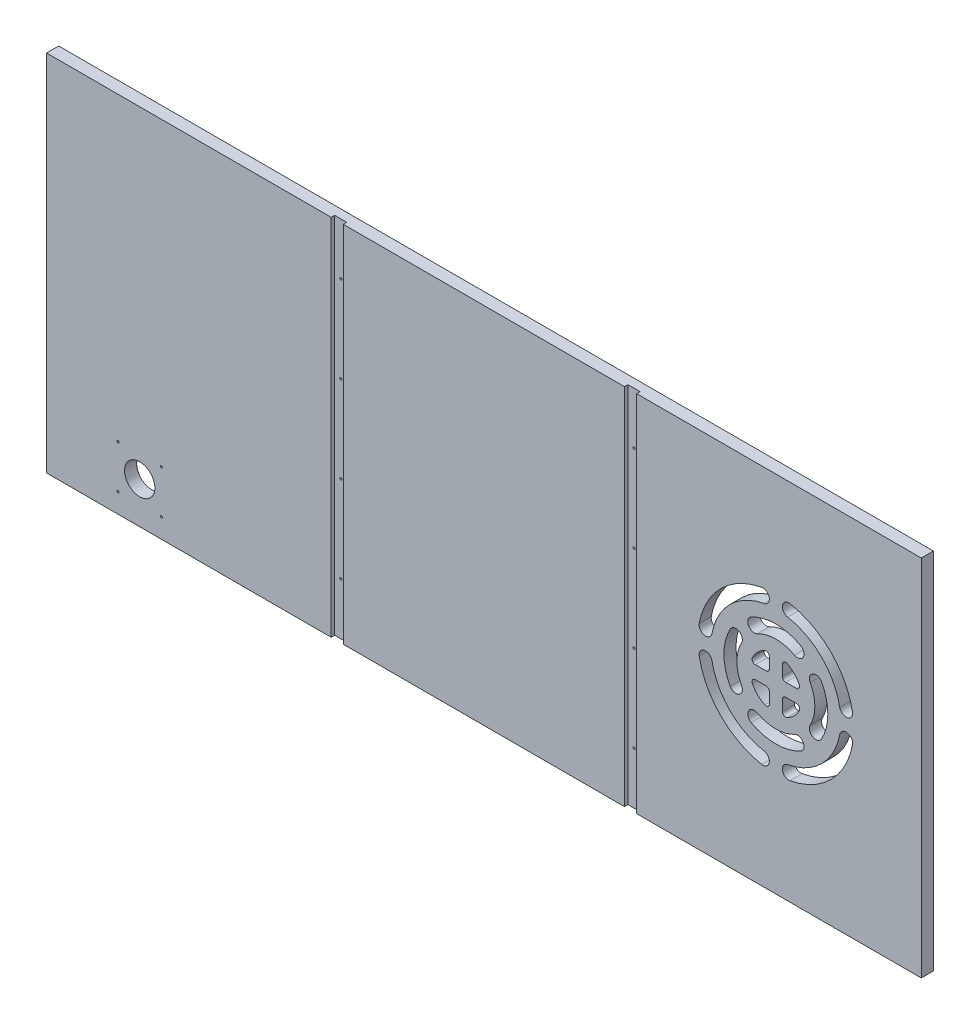
from build123d import *

# Parameters (mm, degrees)
SKETCH2_W          = 1282.7
SKETCH2_H          = 533.4
EXTRUDE1_DEPTH     = 17.78
SKETCH4_R          = 22.225
SKETCH4_R_2        = 1.5875
SKETCH4_R_3        = 1.628860789
SKETCH4_R_4        = 1.721410862
CUT_EXTRUDE1_DEPTH = 17.78
CUT_EXTRUDE2_DEPTH = 5.08


with BuildPart() as part:
    # Sketch2 → Extrude1 (new body)
    with BuildSketch(Plane.XY):
        with Locations((9556.220833334, -6075.3625)):
            Rectangle(SKETCH2_W, SKETCH2_H)
    extrude(amount=-EXTRUDE1_DEPTH)

    # Sketch4 → Cut-Extrude1 (cut)
    with BuildSketch(Plane.XY):
        with Locations((9051.395833334, -6281.7375)):
            Circle(SKETCH4_R)
        with Locations((9019.645833334, -6249.9875)):
            Circle(SKETCH4_R_2)
        with Locations((9083.145833334, -6249.9875)):
            Circle(SKETCH4_R_2)
        with Locations((9083.145833334, -6313.4875)):
            Circle(SKETCH4_R_3)
        with Locations((9019.645833334, -6313.4875)):
            Circle(SKETCH4_R_4)
        with Locations((9341.1675, -6265.8625)):
            Circle(SKETCH4_R_2)
        with Locations((9341.1675, -6138.8625)):
            Circle(SKETCH4_R_2)
        with Locations((9341.1675, -6011.8625)):
            Circle(SKETCH4_R_2)
        with Locations((9341.1675, -5884.8625)):
            Circle(SKETCH4_R_2)
        with Locations((9771.274166666, -5884.8625)):
            Circle(SKETCH4_R_2)
        with Locations((9771.274166666, -6011.8625)):
            Circle(SKETCH4_R_2)
        with Locations((9771.274166666, -6138.8625)):
            Circle(SKETCH4_R_2)
        with Locations((9771.274166666, -6265.8625)):
            Circle(SKETCH4_R_2)
        with BuildLine():
            Line((9974.787433334, -6061.075), (9974.787433334, -6045.241805286))
            ThreePointArc((9974.787433334, -6045.241805286), (9972.570596663, -6041.216758148), (9967.983861906, -6040.938848899))
            ThreePointArc((9967.983861906, -6040.938848899), (9957.371664972, -6048.421731638), (9949.888782233, -6059.033928571))
            ThreePointArc((9949.888782233, -6059.033928571), (9950.166691482, -6063.620663329), (9954.19173862, -6065.8375))
            Line((9954.19173862, -6065.8375), (9970.024933334, -6065.8375))
            ThreePointArc((9970.024933334, -6065.8375), (9973.39252938, -6064.442596045), (9974.787433334, -6061.075))
        make_face()
        with BuildLine():
            Line((9993.837433334, -6045.241805286), (9993.837433334, -6061.075))
            ThreePointArc((9993.837433334, -6061.075), (9995.232337289, -6064.442596045), (9998.599933334, -6065.8375))
            Line((9998.599933334, -6065.8375), (10014.433128046, -6065.8375))
            ThreePointArc((10014.433128046, -6065.8375), (10018.458175184, -6063.620663329), (10018.736084433, -6059.033928571))
            ThreePointArc((10018.736084433, -6059.033928571), (10011.253201696, -6048.421731637), (10000.641004763, -6040.938848899))
            ThreePointArc((10000.641004763, -6040.938848899), (9996.054270005, -6041.216758148), (9993.837433334, -6045.241805286))
        make_face()
        with BuildLine():
            Line((10014.433128046, -6084.8875), (9998.599933334, -6084.8875))
            ThreePointArc((9998.599933334, -6084.8875), (9995.232337289, -6086.282403955), (9993.837433334, -6089.65))
            Line((9993.837433334, -6089.65), (9993.837433334, -6105.483194714))
            ThreePointArc((9993.837433334, -6105.483194714), (9996.054270005, -6109.508241852), (10000.641004763, -6109.786151102))
            ThreePointArc((10000.641004763, -6109.786151102), (10011.253201699, -6102.303268365), (10018.736084435, -6091.691071429))
            ThreePointArc((10018.736084435, -6091.691071429), (10018.458175184, -6087.104336671), (10014.433128046, -6084.8875))
        make_face()
        with BuildLine():
            Line((9970.024933334, -6084.8875), (9954.19173862, -6084.8875))
            ThreePointArc((9954.19173862, -6084.8875), (9950.166691482, -6087.104336671), (9949.888782233, -6091.691071429))
            ThreePointArc((9949.888782233, -6091.691071429), (9957.371664972, -6102.303268362), (9967.983861906, -6109.786151101))
            ThreePointArc((9967.983861906, -6109.786151101), (9972.570596663, -6109.508241852), (9974.787433334, -6105.483194714))
            Line((9974.787433334, -6105.483194714), (9974.787433334, -6089.65))
            ThreePointArc((9974.787433334, -6089.65), (9973.39252938, -6086.282403955), (9970.024933334, -6084.8875))
        make_face()
        with BuildLine():
            ThreePointArc((9890.650044519, -6058.044318182), (9916.960512426, -6008.010579092), (9966.994251516, -5981.700111185))
            ThreePointArc((9966.994251516, -5981.700111185), (9972.584359078, -5978.426082773), (9974.787433334, -5972.333872304))
            ThreePointArc((9974.787433334, -5972.333872304), (9971.354643804, -5965.01194656), (9963.530615152, -5962.967633422))
            ThreePointArc((9963.530615152, -5962.967633422), (9903.490128244, -5994.54019491), (9871.917566756, -6054.580681818))
            ThreePointArc((9871.917566756, -6054.580681818), (9879.551987456, -6065.678738882), (9890.650044519, -6058.044318182))
        make_face()
        with BuildLine():
            ThreePointArc((9890.650044519, -6092.680681818), (9916.960512426, -6142.714420908), (9966.994251516, -6169.024888814))
            ThreePointArc((9966.994251516, -6169.024888814), (9974.628672216, -6180.122945878), (9963.530615152, -6187.757366578))
            ThreePointArc((9963.530615152, -6187.757366578), (9903.490128244, -6156.18480509), (9871.917566756, -6096.144318182))
            ThreePointArc((9871.917566756, -6096.144318182), (9879.551987456, -6085.046261119), (9890.650044519, -6092.680681818))
        make_face()
        with BuildLine():
            ThreePointArc((10001.630615152, -6169.024888815), (10051.664354242, -6142.714420908), (10077.974822149, -6092.680681818))
            ThreePointArc((10077.974822149, -6092.680681818), (10089.072879212, -6085.046261118), (10096.707299912, -6096.144318182))
            ThreePointArc((10096.707299912, -6096.144318182), (10065.134738424, -6156.18480509), (10005.094251516, -6187.757366578))
            ThreePointArc((10005.094251516, -6187.757366578), (9993.996194453, -6180.122945878), (10001.630615152, -6169.024888815))
        make_face()
        with BuildLine():
            ThreePointArc((10001.630615152, -5981.700111185), (10051.664354242, -6008.010579092), (10077.974822148, -6058.044318182))
            ThreePointArc((10077.974822148, -6058.044318182), (10089.072879212, -6065.678738882), (10096.707299912, -6054.580681818))
            ThreePointArc((10096.707299912, -6054.580681818), (10065.134738424, -5994.54019491), (10005.094251516, -5962.967633422))
            ThreePointArc((10005.094251516, -5962.967633422), (9993.996194453, -5970.602054122), (10001.630615152, -5981.700111185))
        make_face()
        with BuildLine():
            ThreePointArc((9917.282231904, -6111.603251872), (9908.112433335, -6075.3625), (9917.282231902, -6039.121748127))
            ThreePointArc((9917.282231902, -6039.121748127), (9930.191101067, -6035.273066932), (9934.039782262, -6048.181936096))
            ThreePointArc((9934.039782262, -6048.181936096), (9927.162433334, -6075.3625), (9934.039782262, -6102.543063904))
            ThreePointArc((9934.039782262, -6102.543063904), (9930.191101067, -6115.451933067), (9917.282231904, -6111.603251872))
        make_face()
        with BuildLine():
            ThreePointArc((9948.071681461, -6008.332298571), (9984.312433334, -5999.162500001), (10020.553185206, -6008.33229857))
            ThreePointArc((10020.553185206, -6008.33229857), (10024.401866401, -6021.241167734), (10011.492997237, -6025.089848928))
            ThreePointArc((10011.492997237, -6025.089848928), (9984.312433332, -6018.212500002), (9957.131869429, -6025.089848928))
            ThreePointArc((9957.131869429, -6025.089848928), (9944.223000266, -6021.241167734), (9948.071681461, -6008.332298571))
        make_face()
        with BuildLine():
            ThreePointArc((10020.553185206, -6142.39270143), (9984.312433334, -6151.5625), (9948.071681462, -6142.39270143))
            ThreePointArc((9948.071681462, -6142.39270143), (9944.223000267, -6129.483832267), (9957.13186943, -6125.635151072))
            ThreePointArc((9957.13186943, -6125.635151072), (9984.312433334, -6132.5125), (10011.492997238, -6125.635151072))
            ThreePointArc((10011.492997238, -6125.635151072), (10024.401866401, -6129.483832267), (10020.553185206, -6142.39270143))
        make_face()
        with BuildLine():
            ThreePointArc((10051.342634764, -6039.121748128), (10060.512433334, -6075.362500001), (10051.342634763, -6111.603251873))
            ThreePointArc((10051.342634763, -6111.603251873), (10038.43373034, -6115.45201683), (10034.585084407, -6102.543063904))
            ThreePointArc((10034.585084407, -6102.543063904), (10041.481307607, -6075.344363194), (10034.638226606, -6048.13224352))
            ThreePointArc((10034.638226606, -6048.13224352), (10038.489557591, -6035.282901746), (10051.342634764, -6039.121748128))
        make_face()
    extrude(amount=-CUT_EXTRUDE1_DEPTH, mode=Mode.SUBTRACT)

    # Sketch5 → Cut-Extrude2 (cut)
    with BuildSketch(Plane.XY):
        Polygon((9350.0575, -6075.3625), (9350.0575, -5808.6625), (9332.2775, -5808.6625), (9332.2775, -6342.0625), (9350.0575, -6342.0625), align=None)
        Polygon((9762.384166666, -6075.3625), (9762.384166666, -6342.0625), (9780.164166666, -6342.0625), (9780.164166666, -5808.6625), (9762.384166666, -5808.6625), align=None)
    extrude(amount=-CUT_EXTRUDE2_DEPTH, mode=Mode.SUBTRACT)


solid = part.part
